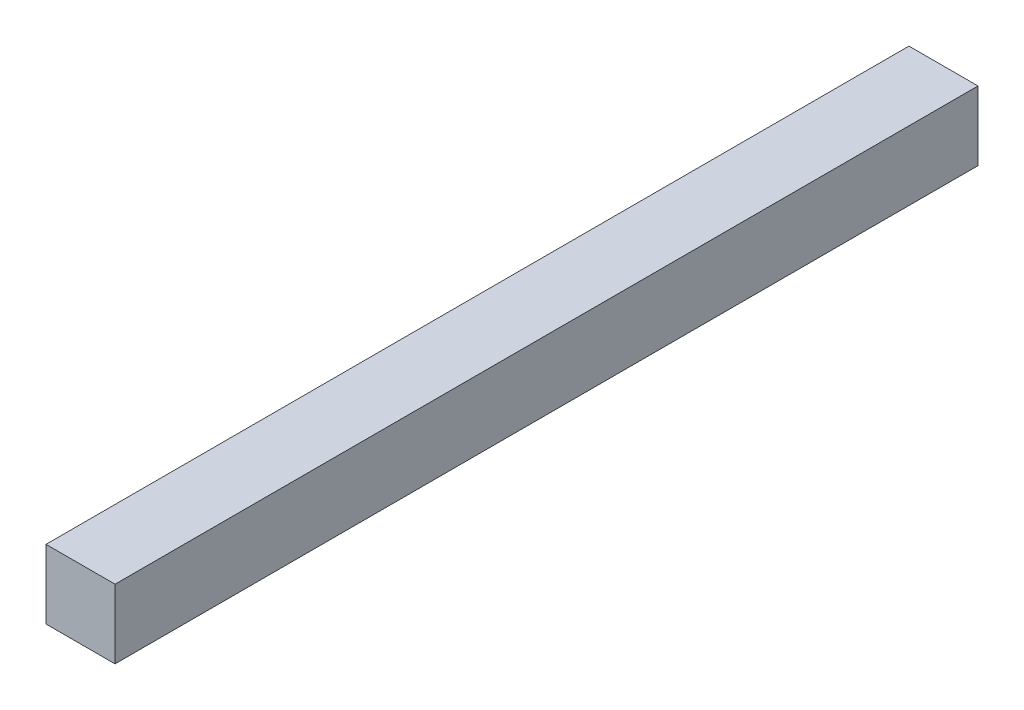
from build123d import *

# Parameters (mm, degrees)
BOSS_EXTRUDE1_DEPTH = 1000


with BuildPart() as part:
    # Sketch1 → Boss-Extrude1 (new body)
    with BuildSketch(Plane.XY):
        Polygon((0, 40), (-40, 40), (-40, -40), (40, -40), (40, 0), (40, 40), align=None)
    extrude(amount=BOSS_EXTRUDE1_DEPTH)


solid = part.part
